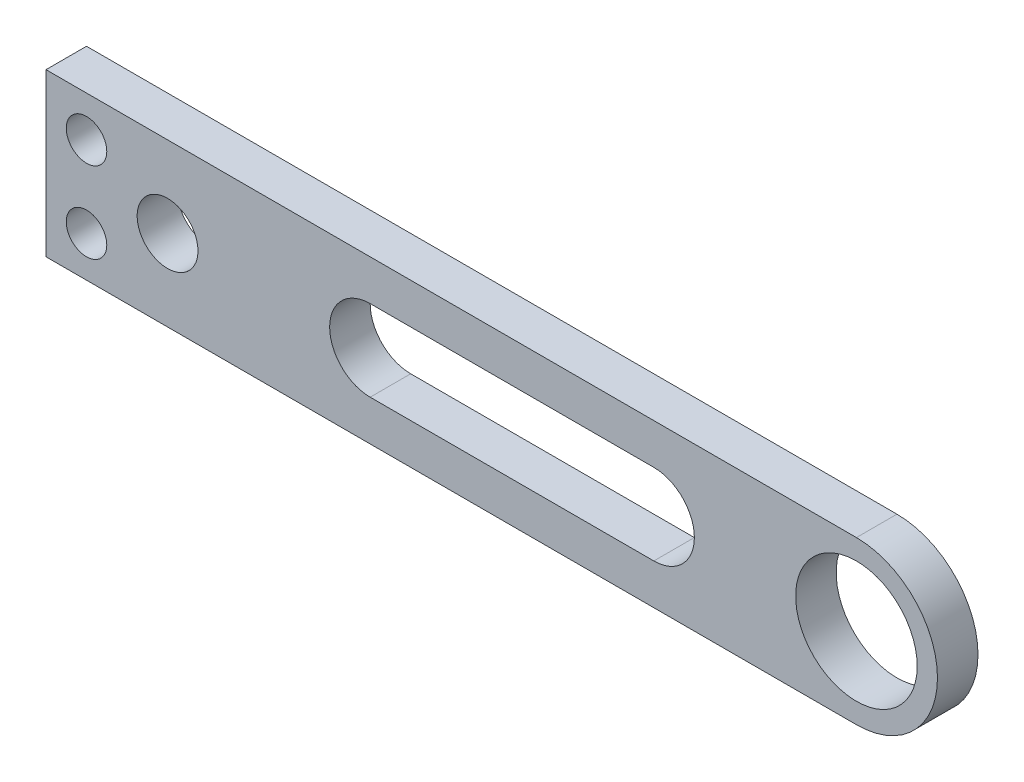
from build123d import *

# Parameters (mm, degrees)
SKETCH_2_R      = 1
SKETCH_2_R_2    = 1.5
SKETCH_2_R_3    = 3
EXTRUDE_1_DEPTH = 2


with BuildPart() as part:
    # 草图2 → 凸台-拉伸1 (new body)
    with BuildSketch(Plane.XY):
        with BuildLine():
            Line((0, 4), (34, 4))
            ThreePointArc((34, 4), (38, 0), (34, -4))
            Line((34, -4), (0, -4))
            Line((0, -4), (-6, -4))
            Line((-6, -4), (-6, 4))
            Line((-6, 4), (0, 4))
        make_face()
        with Locations((-4, 2)):
            Circle(SKETCH_2_R, mode=Mode.SUBTRACT)
        Circle(SKETCH_2_R_2, mode=Mode.SUBTRACT)
        with Locations((34, 0)):
            Circle(SKETCH_2_R_3, mode=Mode.SUBTRACT)
        with Locations((-4, -2)):
            Circle(SKETCH_2_R, mode=Mode.SUBTRACT)
        with BuildLine():
            Line((10, 2), (24, 2))
            ThreePointArc((24, 2), (26, 0), (24, -2))
            Line((24, -2), (10, -2))
            ThreePointArc((10, -2), (8, 0), (10, 2))
        make_face(mode=Mode.SUBTRACT)
    extrude(amount=EXTRUDE_1_DEPTH)


solid = part.part
